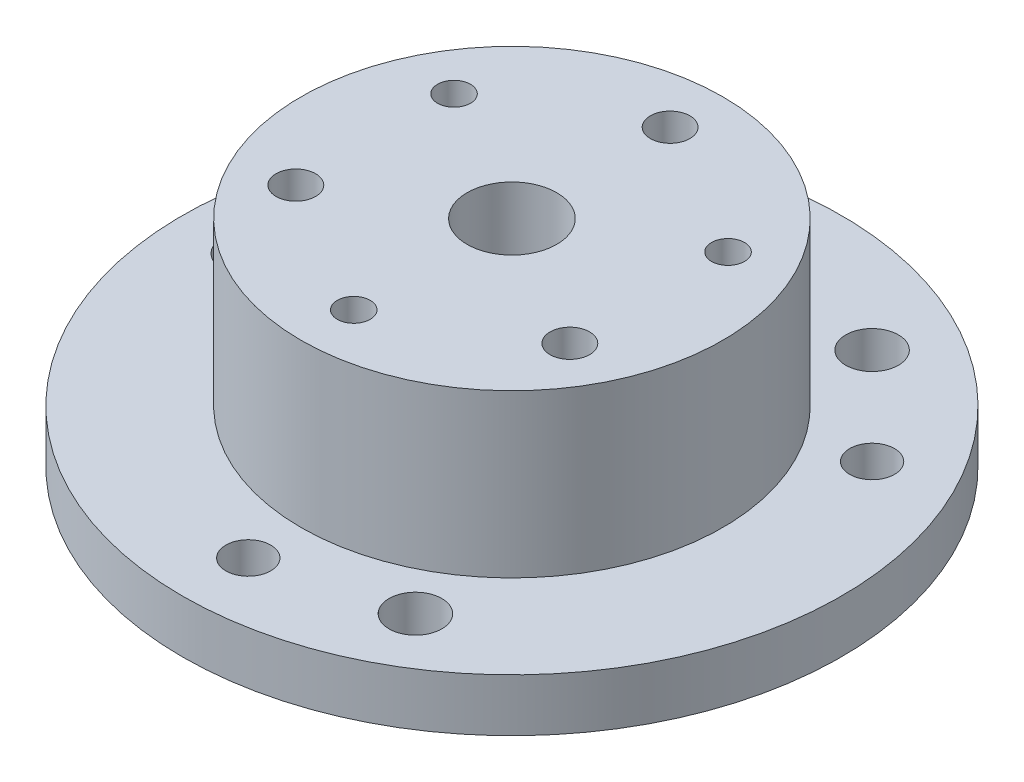
from build123d import *

# Parameters (mm, degrees)
SKETCH1_R               = 25
BOSS_EXTRUDE1_DEPTH     = 4
F_4_0MM_DOWEL_HOLE1_D   = 4
M3_CLEARANCE_HOLE1_D    = 3.4
BOSS_EXTRUDE2_START     = -4
SKETCH9_R               = 16
BOSS_EXTRUDE2_DEPTH     = 16.3
TAP_DRILL_FOR_TAP1_D    = 6.8
F_3_0MM_DOWEL_HOLE1_D   = 3
TAP_DRILL_FOR_M3_TAP1_D = 2.5


with BuildPart() as part:
    # Sketch1 → Boss-Extrude1 (new body)
    with BuildSketch(Plane(origin=(0, 0, 0), x_dir=(1, 0, 0), z_dir=(0, 1, 0))):
        with Locations(Location((0, 0, 0), (0, 0, 270))):
            Circle(SKETCH1_R)
    extrude(amount=BOSS_EXTRUDE1_DEPTH)

    # Ø4.0mm Dowel Hole1 (through all)
    with Locations(Plane(origin=(0, 4, 0), x_dir=(1, 0, 0), z_dir=(0, 1, 0))):
        with Locations((10, -17.320508076), (-20, 0), (10, 17.320508076)):
            Hole(F_4_0MM_DOWEL_HOLE1_D / 2)

    # M3 Clearance Hole1 (through all)
    with Locations(Plane(origin=(0, 4, 0), x_dir=(1, 0, 0), z_dir=(0, 1, 0))):
        with Locations((17.320508076, 10), (0, -20), (-17.320508076, 10)):
            Hole(M3_CLEARANCE_HOLE1_D / 2)

    # Sketch9 → Boss-Extrude2 (add)
    with BuildSketch(Plane(origin=(0, 4, 0), x_dir=(1, 0, 0), z_dir=(0, 1, 0)).offset(BOSS_EXTRUDE2_START)):
        with Locations(Location((0, 0, 0), (0, 0, 270))):
            Circle(SKETCH9_R)
    extrude(amount=BOSS_EXTRUDE2_DEPTH)

    # Tap Drill for  Tap1 (through all)
    with Locations(Plane.XZ):
        with Locations((0, 0)):
            Hole(TAP_DRILL_FOR_TAP1_D / 2)

    # Ø3.0mm Dowel Hole1 (through all)
    with Locations(Plane(origin=(0, 16.3, 0), x_dir=(1, 0, 0), z_dir=(0, 1, 0))):
        with Locations((-10.392304845, -6), (0, 12), (10.392304845, -6)):
            Hole(F_3_0MM_DOWEL_HOLE1_D / 2)

    # Tap Drill for M3 Tap1 (through all)
    with Locations(Plane(origin=(0, 16.3, 0), x_dir=(1, 0, 0), z_dir=(0, 1, 0))):
        with Locations((10.392304845, 6), (0, -12), (-10.392304845, 6)):
            Hole(TAP_DRILL_FOR_M3_TAP1_D / 2)


solid = part.part
